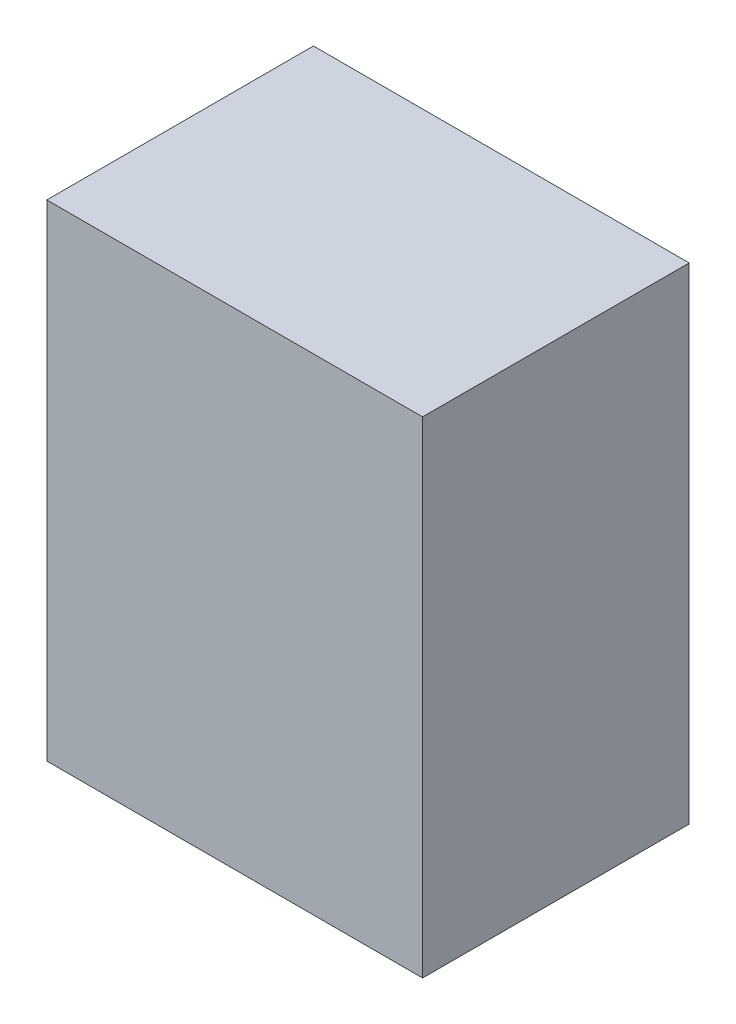
from build123d import *

# Parameters (mm, degrees)
SKETCH1_W               = 6.5532
SKETCH1_H               = 8.4751926
COMPONENT_OUTLINE_DEPTH = 4.6500034


with BuildPart() as part:
    # Sketch1 → Component_Outline (new body)
    with BuildSketch(Plane.XY):
        with Locations((-0.0127, 2.6873835)):
            Rectangle(SKETCH1_W, SKETCH1_H)
    extrude(amount=COMPONENT_OUTLINE_DEPTH)


solid = part.part
